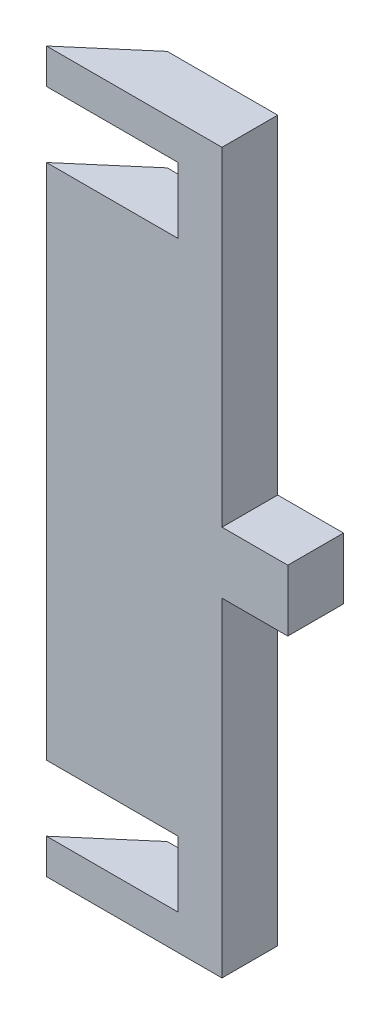
from build123d import *

# Parameters (mm, degrees)
SALIENTE_EXTRUIR1_DEPTH    = 170
CORTAR_EXTRUIR1_DEPTH      = 181.900525151
CORTAR_EXTRUIR1_DEPTH_BACK = 181.900525151
CROQUIS2_W                 = 8
CROQUIS2_H                 = 27
CORTAR_EXTRUIR2_DEPTH      = 181.900525151
CORTAR_EXTRUIR2_DEPTH_BACK = 181.900525151
CROQUIS3_W                 = 38.06511858
CROQUIS3_H                 = 175.826127046
CORTAR_EXTRUIR3_DEPTH      = 177.751237619
CORTAR_EXTRUIR3_DEPTH_BACK = 177.751237619
CROQUIS4_W                 = 35.532251822
CROQUIS4_H                 = 7.536766594
CORTAR_EXTRUIR4_DEPTH      = 177.570920596
CORTAR_EXTRUIR4_DEPTH_BACK = 177.570920596
CROQUIS5_W                 = 14.817344245
CROQUIS5_H                 = 15
CROQUIS5_W_2               = 15.182655755
CROQUIS5_W_3               = 6
CROQUIS5_H_2               = 75
CROQUIS5_H_3               = 6
CROQUIS6_W                 = 9
CROQUIS6_H                 = 14
SALIENTE_EXTRUIR2_DEPTH    = 12.7


with BuildPart() as part:
    # Croquis1 → Saliente-Extruir1 (new body)
    with BuildSketch(Plane(origin=(0, 0, 0), x_dir=(1, 0, 0), z_dir=(0, 1, 0))):
        Polygon((0, 0), (17.50080029, 15), (60, 15), (60, 0), align=None)
    extrude(amount=SALIENTE_EXTRUIR1_DEPTH)

    # Croquis2 → Cortar-Extruir1 (cut, two sides: drawn at the far end of the back side and taken through both)
    with BuildSketch(Plane(origin=(0, 0, -15), x_dir=(-1, 0, 0), z_dir=(0, 0, -1)).offset(-CORTAR_EXTRUIR1_DEPTH_BACK)):
        with Locations((-56, 13.5)):
            Rectangle(CROQUIS2_W, CROQUIS2_H)
        with Locations((-56, 156.5)):
            Rectangle(CROQUIS2_W, CROQUIS2_H)
    extrude(amount=CORTAR_EXTRUIR1_DEPTH + CORTAR_EXTRUIR1_DEPTH_BACK, mode=Mode.SUBTRACT)

    # Croquis3 → Cortar-Extruir2 (cut, two sides: drawn at the far end of the back side and taken through both)
    with BuildSketch(Plane(origin=(0, 0, -15), x_dir=(-1, 0, 0), z_dir=(0, 0, -1)).offset(-CORTAR_EXTRUIR2_DEPTH_BACK)):
        with Locations((-65.03255929, 82.086936477)):
            Rectangle(CROQUIS3_W, CROQUIS3_H)
    extrude(amount=CORTAR_EXTRUIR2_DEPTH + CORTAR_EXTRUIR2_DEPTH_BACK, mode=Mode.SUBTRACT)

    # Croquis4 → Cortar-Extruir3 (cut, two sides: drawn at the far end of the back side and taken through both)
    with BuildSketch(Plane.XZ.offset(-CORTAR_EXTRUIR3_DEPTH_BACK)):
        with Locations((28.233874089, -16.468383297)):
            Rectangle(CROQUIS4_W, CROQUIS4_H)
    extrude(amount=CORTAR_EXTRUIR3_DEPTH + CORTAR_EXTRUIR3_DEPTH_BACK, mode=Mode.SUBTRACT)

    # Croquis5 → Cortar-Extruir4 (cut, two sides: drawn at the far end of the back side and taken through both)
    with BuildSketch(Plane(origin=(0, 0, -12.7), x_dir=(-1, 0, 0), z_dir=(0, 0, -1)).offset(-CORTAR_EXTRUIR4_DEPTH_BACK)):
        with Locations((-7.408672123, 21.5)):
            Rectangle(CROQUIS5_W, CROQUIS5_H)
        with Locations((-22.408672123, 21.5)):
            Rectangle(CROQUIS5_W_2, CROQUIS5_H)
        with Locations((-43, 43.5)):
            Rectangle(CROQUIS5_W_3, CROQUIS5_H_2)
        Polygon((-40, 6), (-46, 6), (-46, 0), (-14.817344245, 0), (-14.817344245, 6), align=None)
        with Locations((-7.408672123, 3)):
            Rectangle(CROQUIS5_W, CROQUIS5_H_3)
        with Locations((-43, 132.5)):
            Rectangle(CROQUIS5_W_3, CROQUIS5_H_2)
        with Locations((-22.408672123, 154.5)):
            Rectangle(CROQUIS5_W_2, CROQUIS5_H)
        with Locations((-7.408672123, 154.5)):
            Rectangle(CROQUIS5_W, CROQUIS5_H)
    extrude(amount=CORTAR_EXTRUIR4_DEPTH + CORTAR_EXTRUIR4_DEPTH_BACK, mode=Mode.SUBTRACT)

    # Croquis6 → Saliente-Extruir2 (add)
    with BuildSketch(Plane(origin=(0, 0, -12.7), x_dir=(-1, 0, 0), z_dir=(0, 0, -1))):
        with Locations((-50.5, 88)):
            Rectangle(CROQUIS6_W, CROQUIS6_H)
    extrude(amount=-SALIENTE_EXTRUIR2_DEPTH)


solid = part.part
